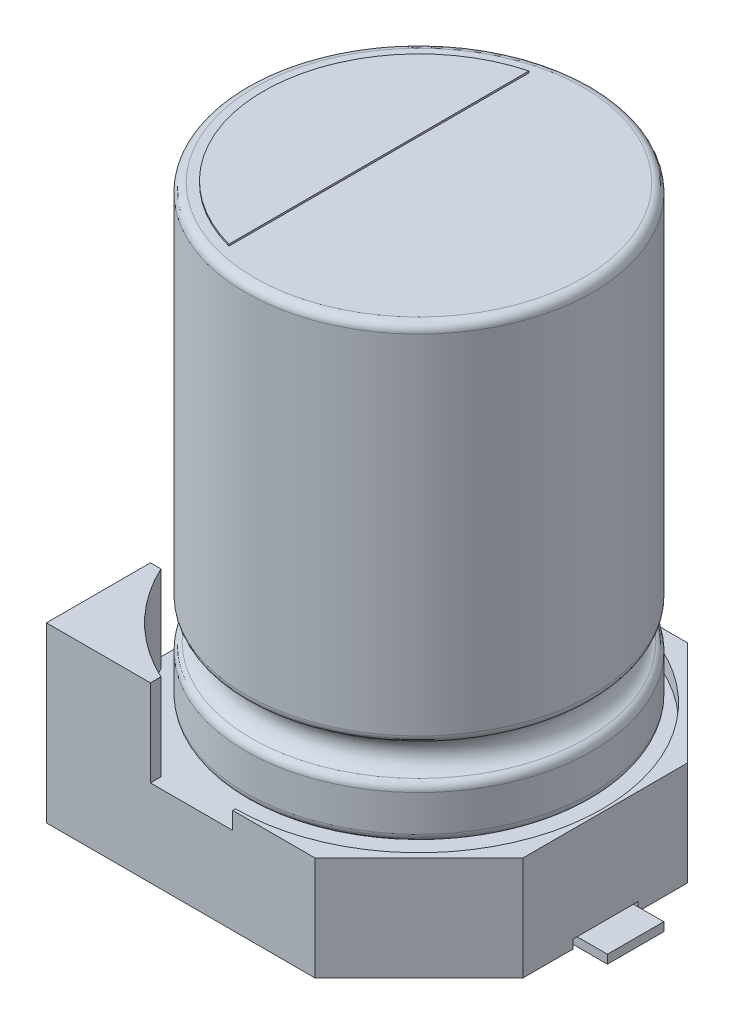
from build123d import *

# Parameters (mm, degrees)
SKETCH_1_W          = 4.3
SKETCH_1_H          = 4.3
EXTRUDE_1_DEPTH     = 1
CUT_EXTRUDE_3_DEPTH = 4.200781155
EXTRUDE_2_DEPTH     = 1
EXTRUDE_3_DEPTH     = 0.2
FILLET_1_R          = 0.1
CUT_EXTRUDE_4_DEPTH = 0.1
SKETCH_11_W         = 0.65
SKETCH_11_H         = 0.1
EXTRUDE_6_DEPTH     = 0.35
SKETCH_12_W         = 0.65
SKETCH_12_H         = 0.1
EXTRUDE_7_DEPTH     = 0.35
EXTRUDE_8_DEPTH     = 0.02


with BuildPart() as part:
    # Эскиз1 → Бобышка-Вытянуть1 (new body)
    with BuildSketch(Plane(origin=(0, 0, 0), x_dir=(1, 0, 0), z_dir=(0, 1, 0))):
        Rectangle(SKETCH_1_W, SKETCH_1_H)
    extrude(amount=EXTRUDE_1_DEPTH)

    # Эскиз2a → Вырез-Вытянуть3 (cut, through all)
    with BuildSketch(Plane(origin=(0, 1, 0), x_dir=(1, 0, 0), z_dir=(0, 1, 0))):
        Polygon((2.15, 0.95), (2.15, 2.15), (0.95, 2.15), align=None)
        Polygon((2.15, -0.95), (2.15, -2.15), (0.95, -2.15), align=None)
    extrude(amount=-CUT_EXTRUDE_3_DEPTH, mode=Mode.SUBTRACT)

    # Эскиз4 → Бобышка-Вытянуть2 (add)
    with BuildSketch(Plane(origin=(0, 1, 0), x_dir=(1, 0, 0), z_dir=(0, 1, 0))):
        with BuildLine():
            Line((-2.15, 0.95), (-2.028570926, 0.95))
            ThreePointArc((-2.028570926, 0.95), (-1.58391919, 1.58391919), (-0.95, 2.028570926))
            Line((-0.95, 2.028570926), (-0.95, 2.15))
            Line((-0.95, 2.15), (-2.15, 2.15))
            Line((-2.15, 2.15), (-2.15, 0.95))
        make_face()
        with BuildLine():
            Line((-0.95, -2.028570926), (-0.95, -2.15))
            Line((-0.95, -2.15), (-2.15, -2.15))
            Line((-2.15, -2.15), (-2.15, -0.95))
            Line((-2.15, -0.95), (-2.028570926, -0.95))
            ThreePointArc((-2.028570926, -0.95), (-1.58391919, -1.58391919), (-0.95, -2.028570926))
        make_face()
    extrude(amount=EXTRUDE_2_DEPTH)

    # Эскиз5 → Бобышка-Вытянуть3 (add)
    with BuildSketch(Plane(origin=(0, 1, 0), x_dir=(1, 0, 0), z_dir=(0, 1, 0))):
        with BuildLine():
            Line((0, 2.118501232), (0, 2.15))
            Line((0, 2.15), (0.95, 2.15))
            Line((0.95, 2.15), (2.15, 0.95))
            Line((2.15, 0.95), (2.15, -0.95))
            Line((2.15, -0.95), (0.95, -2.15))
            Line((0.95, -2.15), (0, -2.15))
            Line((0, -2.15), (0, -2.118501232))
            ThreePointArc((0, -2.118501232), (2.118501232, 0), (0, 2.118501232))
        make_face()
    extrude(amount=EXTRUDE_3_DEPTH)

    # Эскиз10 → Вырез-Вытянуть4 (cut)
    with BuildSketch(Plane.XZ):
        Polygon((-2.15, 0.325), (-2.15, 0.375), (-0.45, 0.375), (-0.45, -0.375), (-2.15, -0.375), (-2.15, -0.325), (-0.5, -0.325), (-0.5, 0.325), align=None)
        Polygon((2.15, 0.375), (0.45, 0.375), (0.45, -0.375), (2.15, -0.375), (2.15, -0.325), (0.5, -0.325), (0.5, 0.325), (2.15, 0.325), align=None)
    extrude(amount=-CUT_EXTRUDE_4_DEPTH, mode=Mode.SUBTRACT)

    # Эскиз11 → Бобышка-Вытянуть6 (add)
    with BuildSketch(Plane(origin=(2.15, 0, 0), x_dir=(0, 0, -1), z_dir=(1, 0, 0))):
        with Locations((0, 0.05)):
            Rectangle(SKETCH_11_W, SKETCH_11_H)
    extrude(amount=EXTRUDE_6_DEPTH)

    # Эскиз12 → Бобышка-Вытянуть7 (add)
    with BuildSketch(Plane.ZY.offset(2.15)):
        with Locations((0, 0.05)):
            Rectangle(SKETCH_12_W, SKETCH_12_H)
    extrude(amount=EXTRUDE_7_DEPTH)


with BuildPart() as body_2:
    # Эскиз9 → Повернуть1 (revolve)
    with BuildSketch(Plane(origin=(0, 0, 0), x_dir=(0, 0, -1), z_dir=(1, 0, 0))):
        with BuildLine():
            Line((2, 1.8), (2, 1.2))
            Line((2, 1.2), (0, 1.2))
            Line((0, 1.2), (0, 6.4))
            Line((0, 6.4), (2, 6.4))
            Line((2, 6.4), (2, 2.2))
            ThreePointArc((2, 2.2), (1.8, 2), (2, 1.8))
        make_face()
    revolve(axis=Axis((0, -0.316749393, 0), (0, 1, 0)))

    # Скругление1
    fillet_1_edges = [body_2.edges().sort_by_distance(p)[0] for p in [
        (0, 6.4, 2),
        (0, 2.2, 2),
        (0, 1.8, 2),
        (0, 1.2, 2),
    ]]
    fillet(fillet_1_edges, radius=FILLET_1_R)

    # Эскиз13 → Бобышка-Вытянуть8 (add)
    with BuildSketch(Plane(origin=(0, 6.4, 0), x_dir=(1, 0, 0), z_dir=(0, 1, 0))):
        with BuildLine():
            Line((-0.462179651, 1.731215258), (-0.462179651, -1.731215258))
            ThreePointArc((-0.462179651, -1.731215258), (-1.791847175, 0), (-0.462179651, 1.731215258))
        make_face()
    extrude(amount=EXTRUDE_8_DEPTH)


solid = Compound([part.part, body_2.part])
